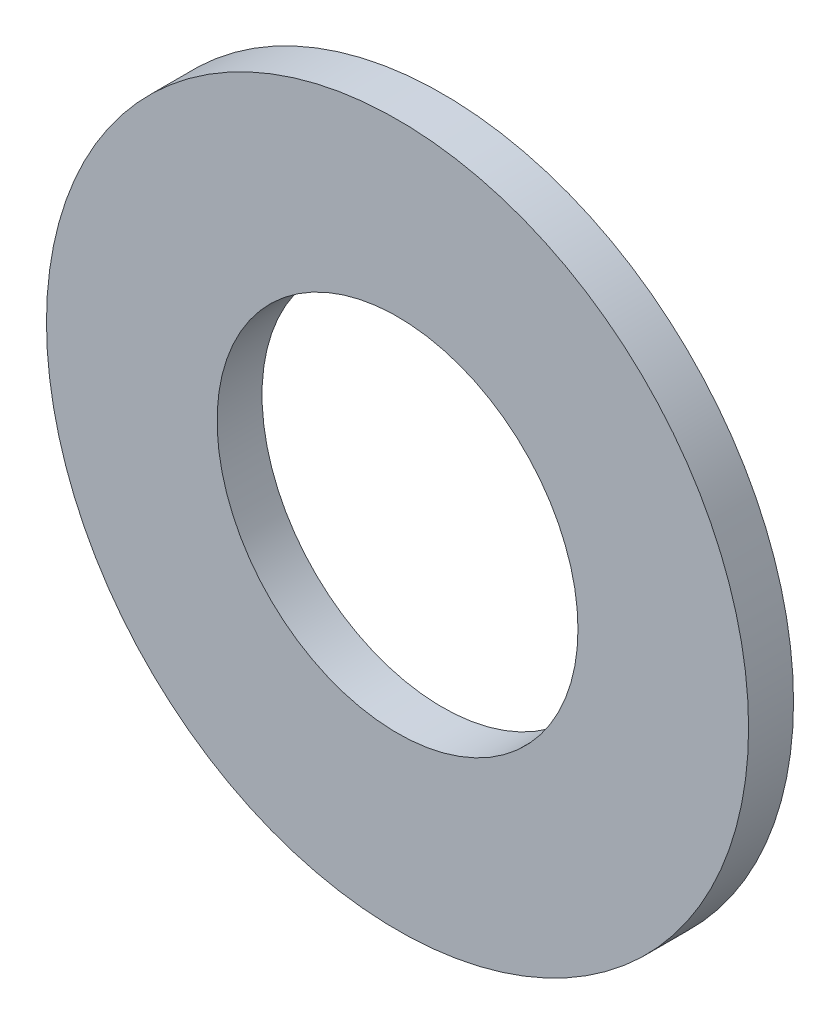
from build123d import *

# Parameters (mm, degrees)
SKETCH1_R               = 6.35
BOSS_EXTRUDE1_DEPTH     = 0.8128
F_1_4_CLEARANCE_HOLE1_D = 6.5278


with BuildPart() as part:
    # Sketch1 → Boss-Extrude1 (new body)
    with BuildSketch(Plane.XY):
        Circle(SKETCH1_R)
    extrude(amount=BOSS_EXTRUDE1_DEPTH)

    # 1/4 Clearance Hole1 (through all)
    with Locations(Plane.XY.offset(0.8128)):
        with Locations((0, 0)):
            Hole(F_1_4_CLEARANCE_HOLE1_D / 2)


solid = part.part
